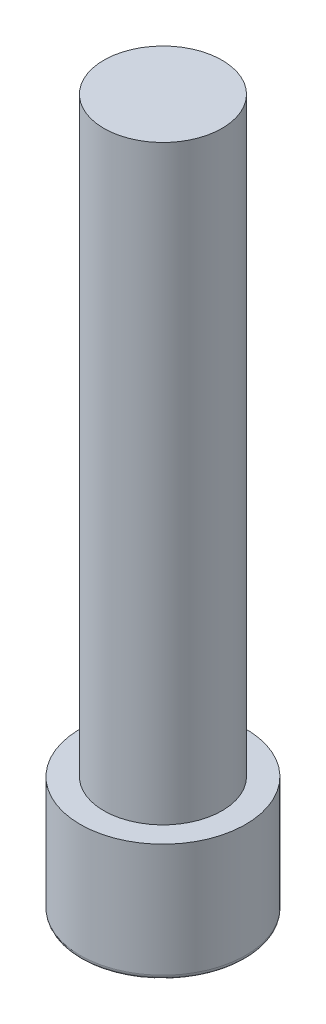
from build123d import *

# Parameters (mm, degrees)
SKETCH1_R           = 3.5
BOSS_EXTRUDE1_DEPTH = 5
SKETCH2_R           = 2.5
BOSS_EXTRUDE2_DEPTH = 25
CUT_EXTRUDE1_DEPTH  = 2
CHAMFER1_SIZE       = 0.25
FILLET1_R           = 0.2


with BuildPart() as part:
    # Sketch1 → Boss-Extrude1 (new body)
    with BuildSketch(Plane(origin=(0, 0, 0), x_dir=(1, 0, 0), z_dir=(0, 1, 0))):
        with Locations(Location((0, 0, 0), (0, 0, 270))):
            Circle(SKETCH1_R)
    extrude(amount=BOSS_EXTRUDE1_DEPTH)

    # Sketch2 → Boss-Extrude2 (add)
    with BuildSketch(Plane(origin=(0, 5, 0), x_dir=(1, 0, 0), z_dir=(0, 1, 0))):
        with Locations(Location((0, 0, 0), (0, 0, 270))):
            Circle(SKETCH2_R)
    extrude(amount=BOSS_EXTRUDE2_DEPTH)

    # Sketch3 → Cut-Extrude1 (cut)
    with BuildSketch(Plane.XZ):
        Polygon((0, 2), (-1.732050808, 1), (-1.732050808, -1), (0, -2), (1.732050808, -1), (1.732050808, 1), align=None)
    extrude(amount=-CUT_EXTRUDE1_DEPTH, mode=Mode.SUBTRACT)

    # Chamfer1
    chamfer1_edges = [part.edges().sort_by_distance(p)[0] for p in [
        (0.866025404, 0, 1.5),
        (-0.866025404, 0, 1.5),
        (-1.732050808, 0, 0),
        (-0.866025404, 0, -1.5),
        (0.866025404, 0, -1.5),
        (1.732050808, 0, 0),
    ]]
    chamfer(chamfer1_edges, length=CHAMFER1_SIZE)

    # Fillet1
    fillet1_edges = [part.edges().sort_by_distance(p)[0] for p in [
        (0, 0, -3.5),
    ]]
    fillet(fillet1_edges, radius=FILLET1_R)


solid = part.part
